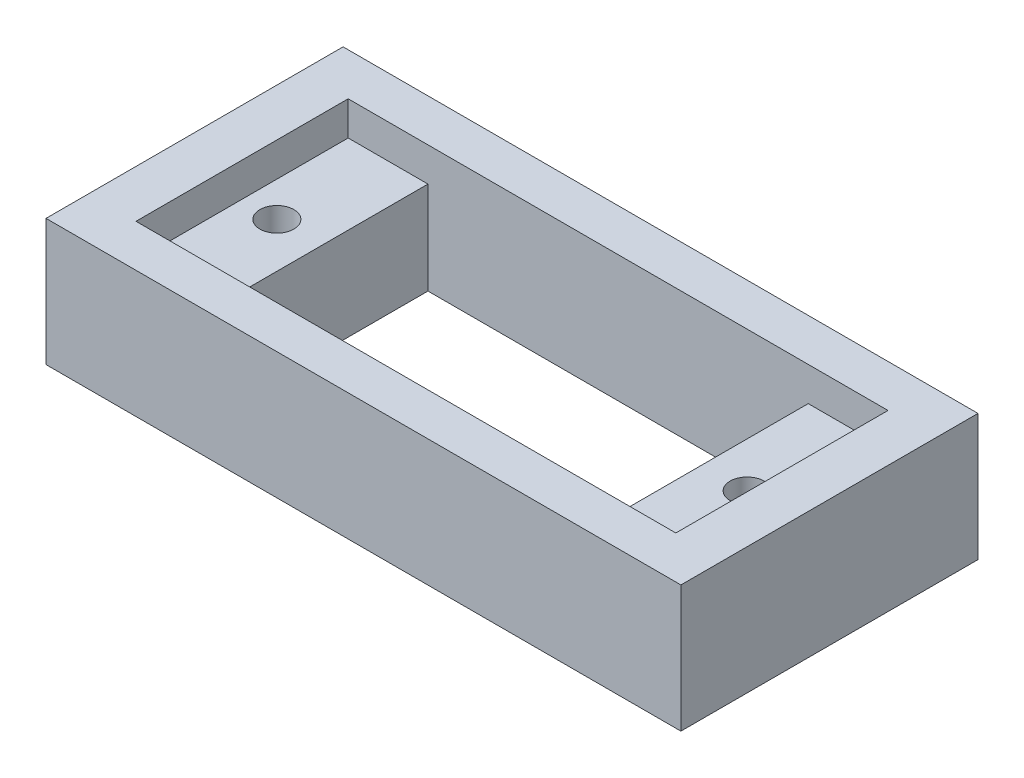
from build123d import *

# Parameters (mm, degrees)
SKETCH1_W           = 37.4
SKETCH1_H           = 17.5
SKETCH1_R           = 1
SKETCH1_W_2         = 22.4
SKETCH1_H_2         = 12.5
BOSS_EXTRUDE1_DEPTH = 7.46
SKETCH2_W           = 31.8
SKETCH2_H           = 12.5
CUT_EXTRUDE1_DEPTH  = 2


with BuildPart() as part:
    # Sketch1 → Boss-Extrude1 (new body)
    with BuildSketch(Plane(origin=(0, 0, 0), x_dir=(1, 0, 0), z_dir=(0, 1, 0))):
        Rectangle(SKETCH1_W, SKETCH1_H)
        with Locations(Location((13.85, 0, 0), (0, 0, 270))):
            Circle(SKETCH1_R, mode=Mode.SUBTRACT)
        with Locations(Location((-13.85, 0, 0), (0, 0, 270))):
            Circle(SKETCH1_R, mode=Mode.SUBTRACT)
        Rectangle(SKETCH1_W_2, SKETCH1_H_2, mode=Mode.SUBTRACT)
    extrude(amount=-BOSS_EXTRUDE1_DEPTH)

    # Sketch2 → Cut-Extrude1 (cut)
    with BuildSketch(Plane(origin=(0, 0, 0), x_dir=(1, 0, 0), z_dir=(0, 1, 0))):
        Rectangle(SKETCH2_W, SKETCH2_H)
    extrude(amount=-CUT_EXTRUDE1_DEPTH, mode=Mode.SUBTRACT)


solid = part.part
